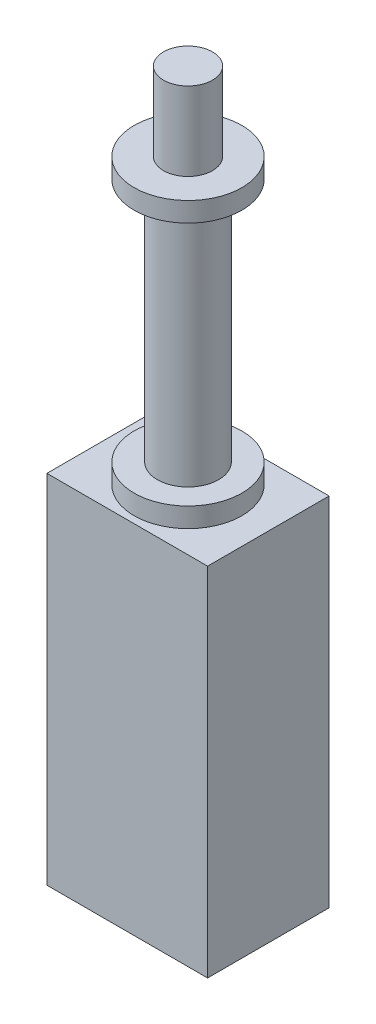
from build123d import *

# Parameters (mm, degrees)
SKETCH1_R      = 34.925
EXTRUDE1_DEPTH = 12.7
SKETCH2_R      = 19.86600399
EXTRUDE2_DEPTH = 184.15
SKETCH3_R      = 15.875
EXTRUDE3_DEPTH = 50.8
EXTRUDE4_START = -12.7
SKETCH4_R      = 34.925
EXTRUDE4_DEPTH = 12.7
SKETCH5_W      = 104.14
SKETCH5_H      = 78.74
EXTRUDE5_DEPTH = 231.14


with BuildPart() as part:
    # Sketch1 → Extrude1 (new body)
    with BuildSketch(Plane(origin=(0, 0, 0), x_dir=(1, 0, 0), z_dir=(0, 1, 0))):
        with Locations(Location((0, 0, 0), (0, 0, 270))):
            Circle(SKETCH1_R)
    extrude(amount=-EXTRUDE1_DEPTH)

    # Sketch2 → Extrude2 (add)
    with BuildSketch(Plane(origin=(0, 0, 0), x_dir=(1, 0, 0), z_dir=(0, 1, 0))):
        with Locations(Location((0, 0, 0), (0, 0, 270))):
            Circle(SKETCH2_R)
    extrude(amount=-EXTRUDE2_DEPTH)

    # Sketch3 → Extrude3 (add)
    with BuildSketch(Plane(origin=(0, 0, 0), x_dir=(1, 0, 0), z_dir=(0, 1, 0))):
        with Locations(Location((0, 0, 0), (0, 0, 270))):
            Circle(SKETCH3_R)
    extrude(amount=EXTRUDE3_DEPTH)

    # Sketch4 → Extrude4 (add)
    with BuildSketch(Plane.XZ.offset(184.15).offset(EXTRUDE4_START)):
        with Locations(Location((0, 0, 0), (0, 0, 90))):
            Circle(SKETCH4_R)
    extrude(amount=EXTRUDE4_DEPTH)

    # Sketch5 → Extrude5 (add)
    with BuildSketch(Plane.XZ.offset(184.15)):
        Rectangle(SKETCH5_W, SKETCH5_H)
    extrude(amount=EXTRUDE5_DEPTH)


solid = part.part
